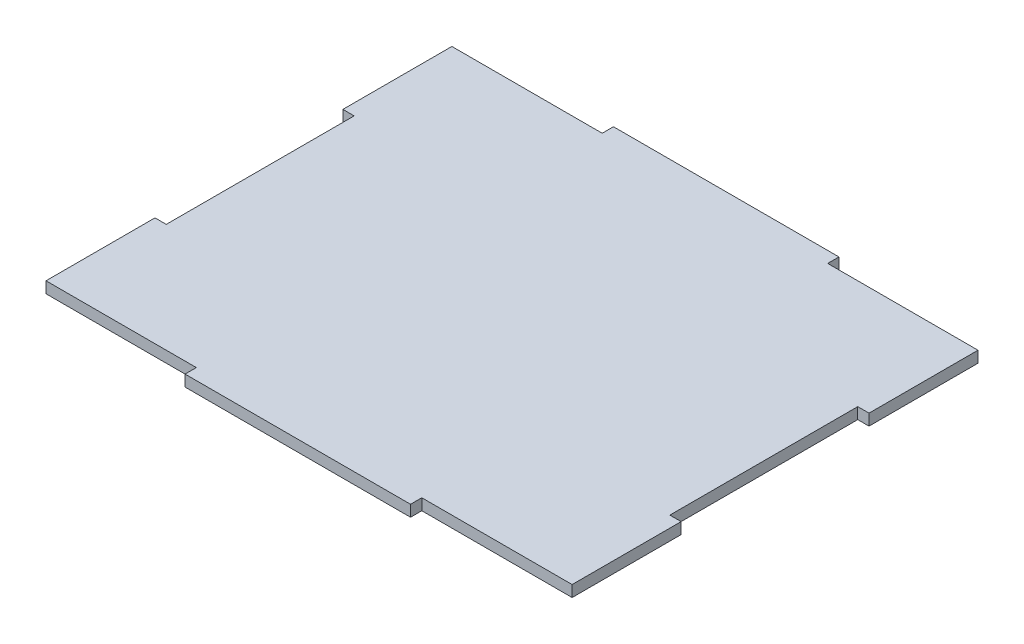
from build123d import *

# Parameters (mm, degrees)
EXTRUDE_1_DEPTH = 3


with BuildPart() as part:
    # Эскиз1 → Бобышка-Вытянуть1 (new body)
    with BuildSketch(Plane(origin=(0, 0, 0), x_dir=(1, 0, 0), z_dir=(0, 1, 0))):
        Polygon((0, 3), (40, 3), (40, 0), (100, 0), (100, 3), (140, 3), (140, 32), (137, 32), (137, 82), (140, 82), (140, 111), (100, 111), (100, 114), (40, 114), (40, 111), (0, 111), (0, 82), (3, 82), (3, 32), (0, 32), align=None)
    extrude(amount=EXTRUDE_1_DEPTH)


solid = part.part
